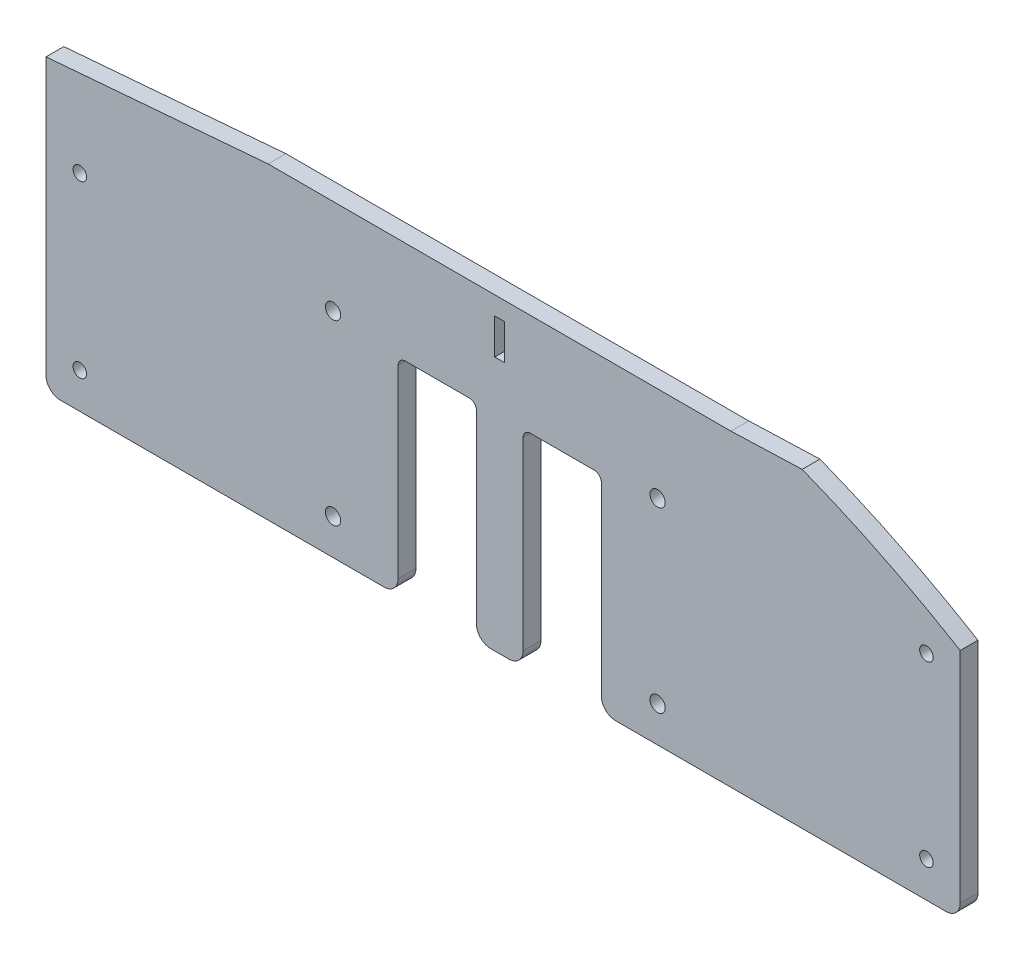
from build123d import *

# Parameters (mm, degrees)
SKETCH1_R           = 1.9
SKETCH1_R_2         = 2.15
SKETCH1_W           = 2.7
SKETCH1_H           = 10
BOSS_EXTRUDE1_DEPTH = 5
BOSS_EXTRUDE2_DEPTH = 5
CUT_EXTRUDE1_DEPTH  = 5


with BuildPart() as part:
    # Sketch1 → Boss-Extrude1 (new body)
    with BuildSketch(Plane.XY):
        with BuildLine():
            Line((-243.5, -252.972288794), (-152.498180394, -252.972288794))
            ThreePointArc((-152.498180394, -252.972288794), (-149.669753269, -251.800715919), (-148.498180394, -248.972288794))
            Line((-148.498180394, -248.972288794), (-148.498180394, -196.970492539))
            ThreePointArc((-148.498180394, -196.970492539), (-147.912393957, -195.556278976), (-146.498180394, -194.970492539))
            Line((-146.498180394, -194.970492539), (-128.498180394, -194.970492539))
            ThreePointArc((-128.498180394, -194.970492539), (-127.083966832, -195.556278976), (-126.498180394, -196.970492539))
            Line((-126.498180394, -196.970492539), (-126.498180394, -248.972288794))
            ThreePointArc((-126.498180394, -248.972288794), (-125.326607519, -251.800715919), (-122.498180394, -252.972288794))
            Line((-122.498180394, -252.972288794), (-117.377838381, -252.972288794))
            ThreePointArc((-117.377838381, -252.972288794), (-114.549411256, -251.800715919), (-113.377838381, -248.972288794))
            Line((-113.377838381, -248.972288794), (-113.377838381, -196.970492539))
            ThreePointArc((-113.377838381, -196.970492539), (-112.792051943, -195.556278976), (-111.377838381, -194.970492539))
            Line((-111.377838381, -194.970492539), (-93.377838381, -194.970492539))
            ThreePointArc((-93.377838381, -194.970492539), (-91.963624819, -195.556278976), (-91.377838381, -196.970492539))
            Line((-91.377838381, -196.970492539), (-91.377838381, -248.972288794))
            ThreePointArc((-91.377838381, -248.972288794), (-90.206265506, -251.800715919), (-87.377838381, -252.972288794))
            Line((-87.377838381, -252.972288794), (5.5, -252.972288794))
            ThreePointArc((5.5, -252.972288794), (8.328427125, -251.800715919), (9.5, -248.972288794))
            Line((9.5, -248.972288794), (9.5, -187.432851256))
            add(Edge.make_bspline(
                [(-75.569581097, -152.972288794), (-30.278898356, -163.497720658), (9.5, -187.432851256)],
                knots=[0, 0, 0, 1, 1, 1], degree=2))
            Line((-75.569581097, -152.972288794), (-118.65, -152.972288794))
            Line((-118.65, -152.972288794), (-118.65, -162.972288794))
            Line((-118.65, -162.972288794), (-121.35, -162.972288794))
            Line((-121.35, -162.972288794), (-121.35, -152.972288794))
            Line((-121.35, -152.972288794), (-164.430418903, -152.972288794))
            add(Edge.make_bspline(
                [(-164.430418903, -152.972288794), (-207.794171984, -154.134737544), (-247.5, -171.407059989)],
                knots=[0, 0, 0, 1, 1, 1], degree=2))
            Line((-247.5, -171.407059989), (-247.5, -248.972288794))
            ThreePointArc((-247.5, -248.972288794), (-246.328427125, -251.800715919), (-243.5, -252.972288794))
        make_face()
        with Locations((0, -192.921490239)):
            Circle(SKETCH1_R, mode=Mode.SUBTRACT)
        with Locations((0, -242.921490239)):
            Circle(SKETCH1_R, mode=Mode.SUBTRACT)
        with Locations((-237.993794987, -242.921490239)):
            Circle(SKETCH1_R, mode=Mode.SUBTRACT)
        with Locations((-237.993794987, -194.970492539)):
            Circle(SKETCH1_R, mode=Mode.SUBTRACT)
        with Locations((-166.815366628, -192.921490239)):
            Circle(SKETCH1_R_2, mode=Mode.SUBTRACT)
        with Locations((-166.815366628, -242.921490239)):
            Circle(SKETCH1_R_2, mode=Mode.SUBTRACT)
        with Locations((-75.569581097, -192.921490239)):
            Circle(SKETCH1_R_2, mode=Mode.SUBTRACT)
        with Locations((-75.569581097, -242.921490239)):
            Circle(SKETCH1_R_2, mode=Mode.SUBTRACT)
        with Locations((-120, -176.407059989)):
            Rectangle(SKETCH1_W, SKETCH1_H, mode=Mode.SUBTRACT)
    extrude(amount=BOSS_EXTRUDE1_DEPTH)

    # Sketch2 → Boss-Extrude2 (add)
    with BuildSketch(Plane(origin=(0, 0, 0), x_dir=(-1, 0, 0), z_dir=(0, 0, -1))):
        with BuildLine():
            Line((247.500000017, -171.407059996), (185.05842867, -166.255233236))
            Line((185.05842867, -166.255233236), (54.943181018, -166.255233236))
            Line((54.943181018, -166.255233236), (34.928242723, -165.547963122))
            add(Edge.make_bspline(
                [(58.315946636, -155.801157817), (45.893296778, -158.75444176), (34.928242723, -165.547963122)],
                knots=[0, 0, 0, 1, 1, 1], degree=2))
            add(Edge.make_bspline(
                [(58.315946636, -155.801157817), (63.424678897, -156.071648314), (70.654281497, -151.741484529)],
                knots=[0, 0, 0, 0.409142446, 0.409142446, 0.409142446], degree=2))
            add(Edge.make_bspline(
                [(113.326199409, -148.857198457), (91.886453079, -148.664892877), (70.654281497, -151.741484529)],
                knots=[0, 0, 0, 1, 1, 1], degree=2))
            Line((113.326199409, -148.857198457), (126.673800592, -148.857198457))
            add(Edge.make_bspline(
                [(185.597069482, -153.384908978), (156.563126475, -146.928393886), (126.673800592, -148.857198457)],
                knots=[0, 0, 0, 1, 1, 1], degree=2))
            add(Edge.make_bspline(
                [(185.597069482, -153.384908978), (219.13818523, -148.75209862), (247.500000017, -171.407059996)],
                knots=[0, 0, 0, 1, 1, 1], degree=2))
        make_face()
    extrude(amount=-BOSS_EXTRUDE2_DEPTH)

    # Sketch2<2> → Cut-Extrude1 (cut)
    with BuildSketch(Plane(origin=(0, 0, 0), x_dir=(-1, 0, 0), z_dir=(0, 0, -1))):
        with BuildLine():
            Line((185.05842867, -166.255233236), (247.500000017, -171.407059996))
            add(Edge.make_bspline(
                [(185.597069482, -153.384908978), (219.13818523, -148.75209862), (247.500000017, -171.407059996)],
                knots=[0, 0, 0, 1, 1, 1], degree=2))
            add(Edge.make_bspline(
                [(185.597069482, -153.384908978), (156.563126475, -146.928393886), (126.673800592, -148.857198457)],
                knots=[0, 0, 0, 1, 1, 1], degree=2))
            Line((126.673800592, -148.857198457), (113.326199409, -148.857198457))
            add(Edge.make_bspline(
                [(113.326199409, -148.857198457), (91.886453079, -148.664892877), (70.654281497, -151.741484529)],
                knots=[0, 0, 0, 1, 1, 1], degree=2))
            add(Edge.make_bspline(
                [(58.315946636, -155.801157817), (63.424678897, -156.071648314), (70.654281497, -151.741484529)],
                knots=[0, 0, 0, 0.409142446, 0.409142446, 0.409142446], degree=2))
            add(Edge.make_bspline(
                [(58.315946636, -155.801157817), (45.893296778, -158.75444176), (34.928242723, -165.547963122)],
                knots=[0, 0, 0, 1, 1, 1], degree=2))
            Line((34.928242723, -165.547963122), (54.943181018, -166.255233236))
            Line((54.943181018, -166.255233236), (185.05842867, -166.255233236))
        make_face()
    extrude(amount=-CUT_EXTRUDE1_DEPTH, mode=Mode.SUBTRACT)


solid = part.part
